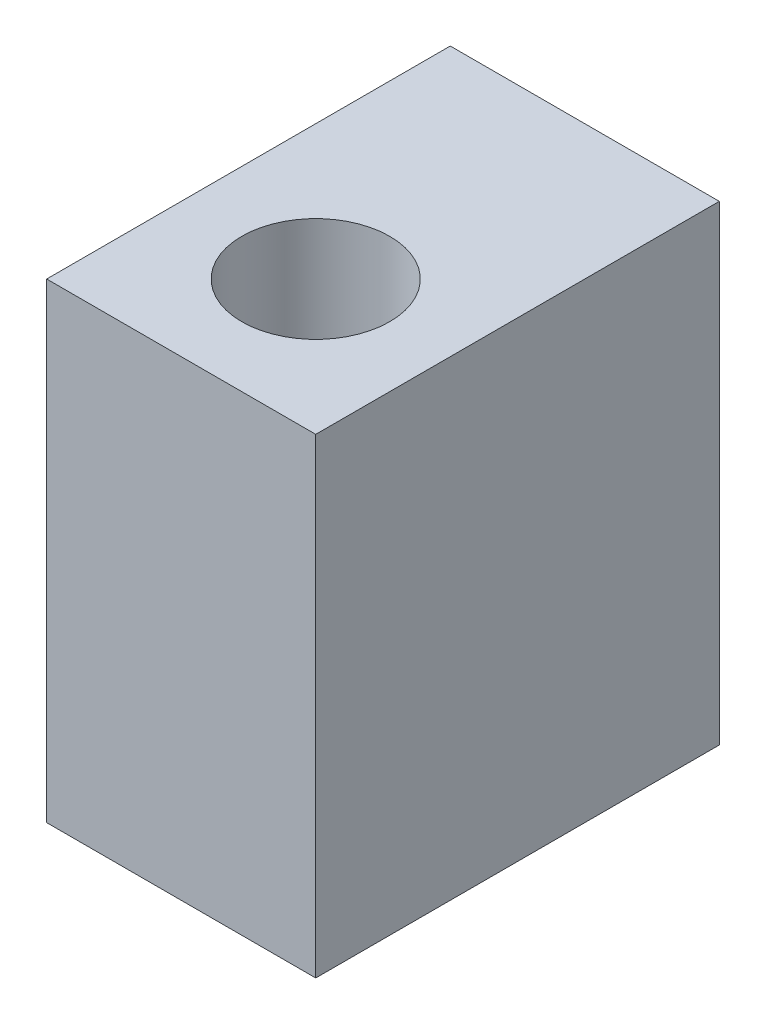
from build123d import *

# Parameters (mm, degrees)
SKETCH_1_W          = 4
SKETCH_1_H          = 6
EXTRUDE_1_DEPTH     = 7
SKETCH_3_R          = 1.1
CUT_EXTRUDE_1_DEPTH = 10.054741426


with BuildPart() as part:
    # 草图1 → 凸台-拉伸1 (new body)
    with BuildSketch(Plane(origin=(0, 0, 0), x_dir=(1, 0, 0), z_dir=(0, 1, 0))):
        with Locations((0.8125, -2.0078125)):
            Rectangle(SKETCH_1_W, SKETCH_1_H)
    extrude(amount=EXTRUDE_1_DEPTH)

    # 草图3 → 切除-拉伸1 (cut, through all)
    with BuildSketch(Plane.XZ):
        with Locations(Location((0.8125, 3.0078125, 0), (0, 0, 270))):
            Circle(SKETCH_3_R)
    extrude(amount=-CUT_EXTRUDE_1_DEPTH, mode=Mode.SUBTRACT)


solid = part.part
